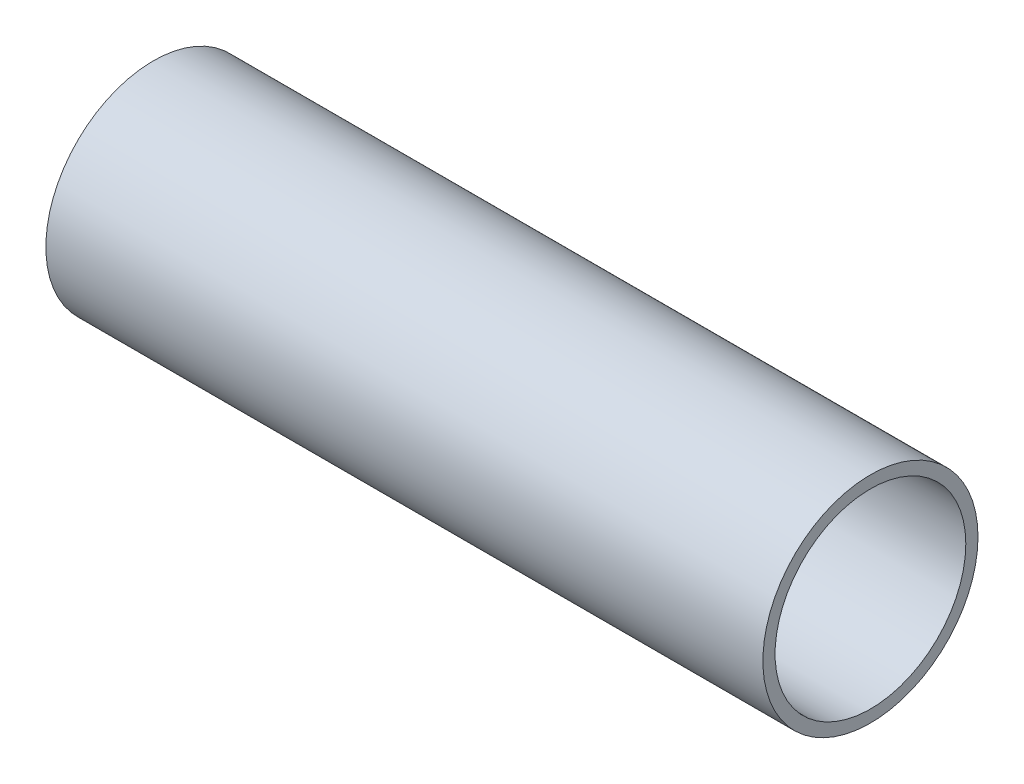
from build123d import *

# Parameters (mm, degrees)
SKETCH1_R      = 15
SKETCH1_R_2    = 13.3
EXTRUDE1_DEPTH = 100


with BuildPart() as part:
    # Sketch1 → Extrude1 (new body)
    with BuildSketch(Plane(origin=(0, 0, 0), x_dir=(0, 0, -1), z_dir=(1, 0, 0))):
        Circle(SKETCH1_R)
        Circle(SKETCH1_R_2, mode=Mode.SUBTRACT)
    extrude(amount=EXTRUDE1_DEPTH)


solid = part.part
